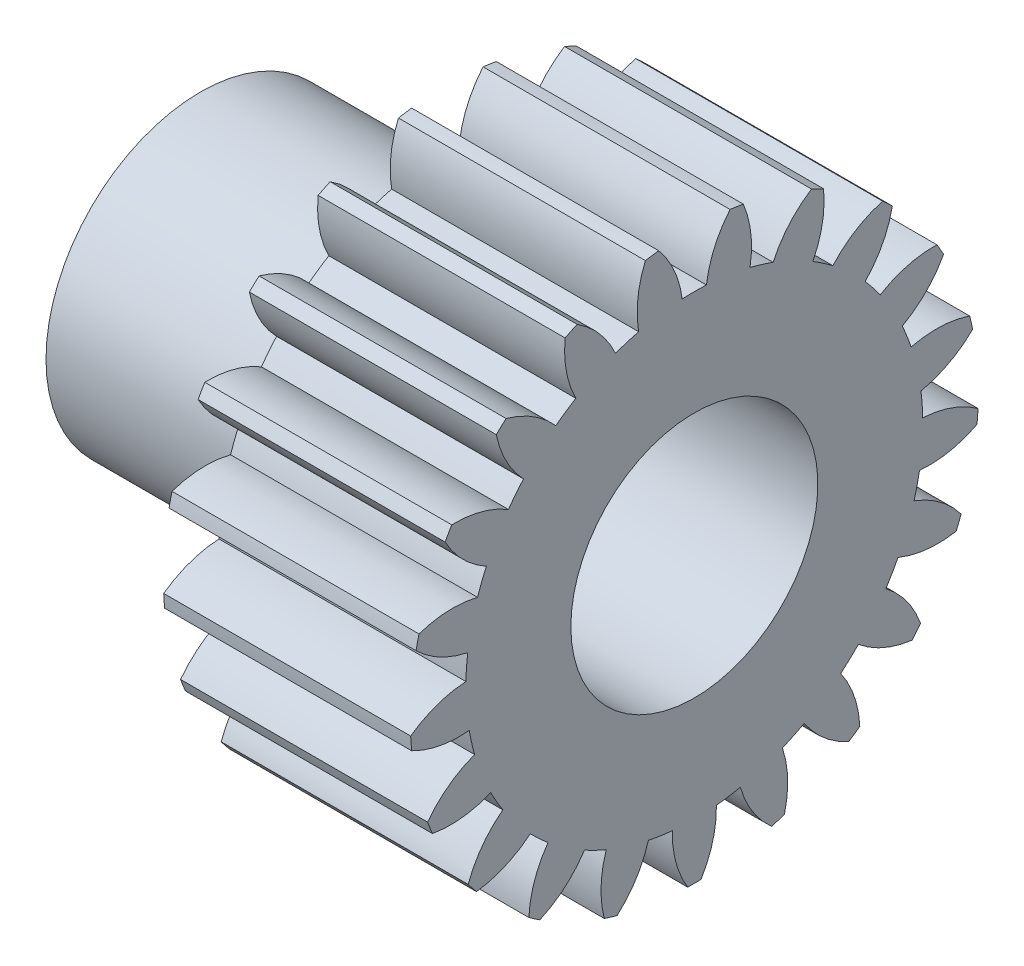
from build123d import *

# Parameters (mm, degrees)
BASPROSKE_W      = 60
BASPROSKE_H      = 69
TOOTHCUT_DEPTH   = 115.551298552
TEETHCUTS_COUNT  = 21
TEETHCUTS_ANGLE  = 342.857142857
HUBNEAONESKE_R   = 37.5
HUBNEARONE_DEPTH = 60.0000508
BORSKE_R         = 30
BORE_DEPTH       = 120.0000508


with BuildPart() as part:
    # BasProSke → Base-Revolve (revolve)
    with BuildSketch(Plane(origin=(0, 0, 0), x_dir=(1, 0, 0), z_dir=(0, 1, 0)), mode=Mode.PRIVATE) as base_revolve_sk:
        with Locations((30, 34.5)):
            Rectangle(BASPROSKE_W, BASPROSKE_H)
    revolve(base_revolve_sk.sketch.rotate(Axis((-10, 0, 0), (1, 0, 0)), 180), axis=Axis((-10, 0, 0), (1, 0, 0)))

    # TooCutSke → ToothCut (cut, through all)
    with BuildSketch(Plane(origin=(0, 0, 0), x_dir=(0, 0, -1), z_dir=(1, 0, 0))):
        with BuildLine():
            ThreePointArc((2.93985266, 55.421081434), (0, 55.499), (-2.93985266, 55.421081434))
            ThreePointArc((-2.93985266, 55.421081434), (-4.874938915, 62.364127365), (-8.696301499, 68.475398395))
            ThreePointArc((-8.696301499, 68.475398395), (0, 69.0254), (8.696301499, 68.475398395))
            ThreePointArc((8.696301499, 68.475398395), (4.874938915, 62.364127365), (2.93985266, 55.421081434))
        make_face()
    toothcut = extrude(amount=TOOTHCUT_DEPTH, mode=Mode.SUBTRACT)

    # TeethCuts: ToothCut ×21 about axis
    teethcuts_axis = Axis((-10, 0, 0), (1, 0, 0))
    for i in range(1, TEETHCUTS_COUNT):
        add(toothcut.rotate(teethcuts_axis, i * TEETHCUTS_ANGLE / (TEETHCUTS_COUNT - 1)), mode=Mode.SUBTRACT)

    # HubNeaOneSke → HubNearOne (add)
    with BuildSketch(Plane.ZY):
        with Locations(Location((0, 0, 0), (0, 0, 180))):
            Circle(HUBNEAONESKE_R)
    extrude(amount=HUBNEARONE_DEPTH)

    # BorSke → Bore (cut, symmetric)
    with BuildSketch(Plane(origin=(0, 0, 0), x_dir=(0, 0, -1), z_dir=(1, 0, 0))):
        with Locations(Location((0, 0, 0), (0, 0, 180))):
            Circle(BORSKE_R)
    extrude(amount=BORE_DEPTH, both=True, mode=Mode.SUBTRACT)


solid = part.part
